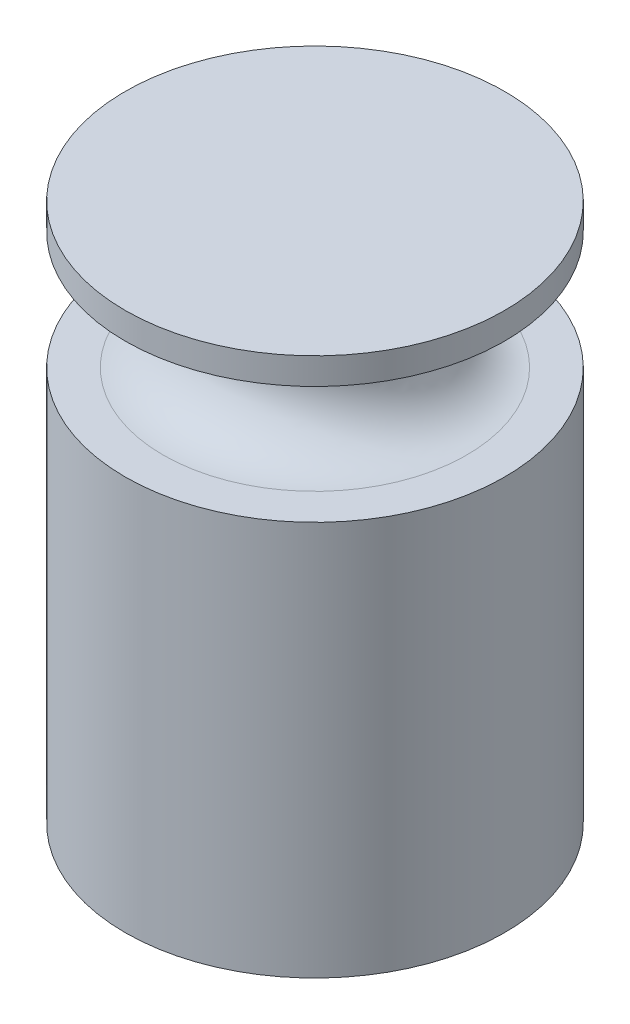
from build123d import *


with BuildPart() as part:
    # Sketch1 → Revolve1 (revolve)
    with BuildSketch(Plane.XY, mode=Mode.PRIVATE) as revolve1_sk:
        with BuildLine():
            Line((0, 0), (25, 0))
            Line((25, 0), (25, 52))
            Line((25, 52), (20, 52))
            ThreePointArc((20, 52), (12.25, 59.75), (20, 67.5))
            Line((20, 67.5), (25, 67.5))
            Line((25, 67.5), (25, 71))
            Line((25, 71), (0, 71))
            Line((0, 71), (0, 0))
        make_face()
    revolve(revolve1_sk.sketch.rotate(Axis((0, 52.603832235, 0), (0, -1, 0)), 90), axis=Axis((0, 52.603832235, 0), (0, -1, 0)))


solid = part.part
